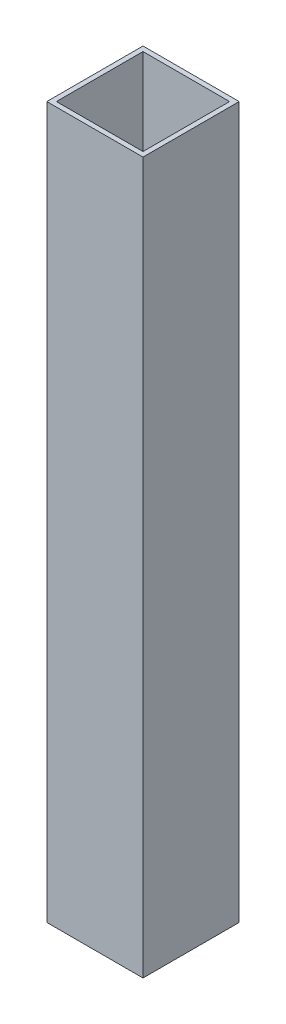
from build123d import *

# Parameters (mm, degrees)
SKETCH1_W           = 20
SKETCH1_H           = 20
SKETCH1_W_2         = 18
SKETCH1_H_2         = 18
BOSS_EXTRUDE1_DEPTH = 147.8


with BuildPart() as part:
    # Sketch1 → Boss-Extrude1 (new body)
    with BuildSketch(Plane(origin=(0, 0, 0), x_dir=(1, 0, 0), z_dir=(0, 1, 0))):
        Rectangle(SKETCH1_W, SKETCH1_H)
        Rectangle(SKETCH1_W_2, SKETCH1_H_2, mode=Mode.SUBTRACT)
    extrude(amount=BOSS_EXTRUDE1_DEPTH)


solid = part.part
